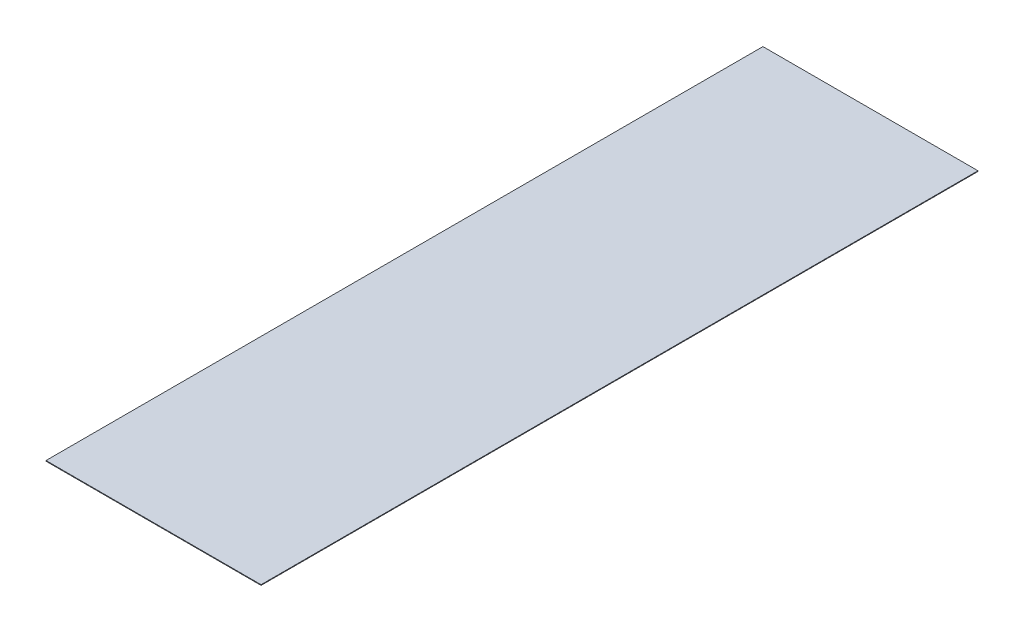
from build123d import *

# Parameters (mm, degrees)
CROQUIS1_W              = 914.4
CROQUIS1_H              = 3048
SALIENTE_EXTRUIR1_DEPTH = 2.7


with BuildPart() as part:
    # Croquis1 → Saliente-Extruir1 (new body)
    with BuildSketch(Plane(origin=(0, 0, 0), x_dir=(1, 0, 0), z_dir=(0, 1, 0))):
        Rectangle(CROQUIS1_W, CROQUIS1_H)
    extrude(amount=SALIENTE_EXTRUIR1_DEPTH)


solid = part.part
